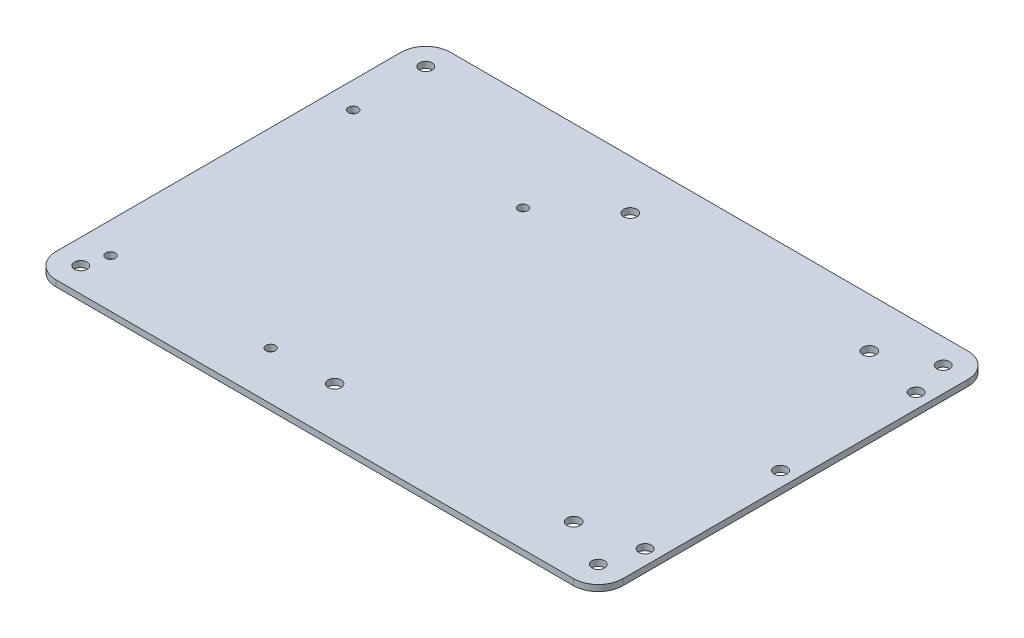
from build123d import *

# Parameters (mm, degrees)
SKETCH1_W                 = 146.05
SKETCH1_H                 = 101.6
BOSS_EXTRUDE1_DEPTH       = 1.5875
FILLET1_R                 = 6.35
F_4_CLEARANCE_HOLE1_D     = 3.2639
F_4_CLEARANCE_HOLE1_DEPTH = 50.8
F_4_CLEARANCE_HOLE1_TIP   = 0.980574487
M3_CLEARANCE_HOLE1_D      = 3.4
F_4_CLEARANCE_HOLE2_D     = 3.2639
F_2_CLEARANCE_HOLE1_D     = 2.4384


with BuildPart() as part:
    # Sketch1 → Boss-Extrude1 (new body)
    with BuildSketch(Plane(origin=(0, 0, 0), x_dir=(1, 0, 0), z_dir=(0, 1, 0))):
        Rectangle(SKETCH1_W, SKETCH1_H)
    extrude(amount=BOSS_EXTRUDE1_DEPTH)

    # Fillet1
    fillet1_edges = [part.edges().sort_by_distance(p)[0] for p in [
        (73.025, 0.79375, 50.8),
        (-73.025, 0.79375, 50.8),
        (-73.025, 0.79375, -50.8),
        (73.025, 0.79375, -50.8),
    ]]
    fillet(fillet1_edges, radius=FILLET1_R)

    # #4 Clearance Hole1
    with Locations(Plane(origin=(0, 1.5875, 0), x_dir=(-1, 0, 0), z_dir=(0, 1, 0))):
        with Locations((-66.675, 44.45), (-66.675, -44.45), (66.675, -44.45), (66.675, 44.45)):
            Hole(F_4_CLEARANCE_HOLE1_D / 2, depth=F_4_CLEARANCE_HOLE1_DEPTH)
            with Locations((0, 0, -(F_4_CLEARANCE_HOLE1_DEPTH + F_4_CLEARANCE_HOLE1_TIP / 2))):  # 118° drill point
                Cone(0, F_4_CLEARANCE_HOLE1_D / 2, F_4_CLEARANCE_HOLE1_TIP, mode=Mode.SUBTRACT)

    # M3 Clearance Hole1 (through all)
    with Locations(Plane(origin=(0, 1.5875, 0), x_dir=(-1, 0, 0), z_dir=(0, 1, 0))):
        with Locations((7.62, -38.1), (-53.975, -38.1), (7.62, 38.1), (-53.975, 38.1)):
            Hole(M3_CLEARANCE_HOLE1_D / 2)

    # #4 Clearance Hole2 (through all)
    with Locations(Plane(origin=(0, 1.5875, 0), x_dir=(-1, 0, 0), z_dir=(0, 1, 0))):
        with Locations((-69.215, 0), (-69.215, 34.925), (-69.215, -34.925)):
            Hole(F_4_CLEARANCE_HOLE2_D / 2)

    # #2 Clearance Hole1 (through all)
    with Locations(Plane.XZ):
        with Locations((-66.3194, -25.4), (-22.5806, -25.4), (-65.0875, 38.3794), (-23.8125, 38.3794)):
            Hole(F_2_CLEARANCE_HOLE1_D / 2)


solid = part.part
